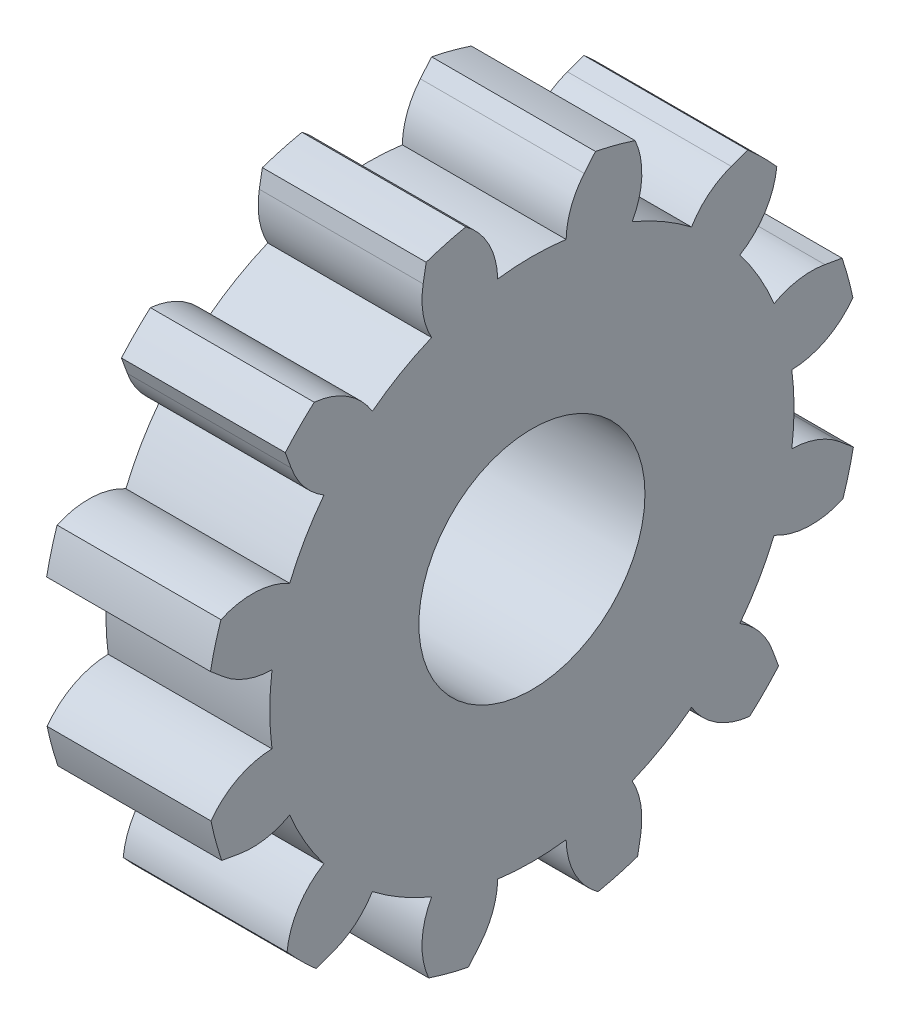
from build123d import *

# Parameters (mm, degrees)
SKETCH3_R           = 10
BOSS_EXTRUDE1_DEPTH = 5
CUT_EXTRUDE1_DEPTH  = 5
CIRPATTERN1_COUNT   = 12
SKETCH3_3_R         = 3.45
CUT_EXTRUDE3_DEPTH  = 5


with BuildPart() as part:
    # Sketch3 → Boss-Extrude1 (new body)
    with BuildSketch(Plane(origin=(0, 0, 0), x_dir=(0, 0, -1), z_dir=(1, 0, 0))):
        Circle(SKETCH3_R)
    extrude(amount=BOSS_EXTRUDE1_DEPTH)

    # Gear_Profile → Cut-Extrude1 (cut)
    with BuildSketch(Plane.ZY):
        with BuildLine():
            ThreePointArc((-1.595423995, 9.401352278), (-1.193917878, 8.71367126), (-1.044209538, 7.931558891))
            ThreePointArc((-1.044209538, 7.931558891), (0, 8), (1.044209538, 7.931558891))
            ThreePointArc((1.044209538, 7.931558891), (1.311715504, 8.977395553), (2.017271047, 9.794417671))
            ThreePointArc((2.017271047, 9.794417671), (0.040143535, 9.999919425), (-1.938570153, 9.810297945))
            Line((-1.938570153, 9.810297945), (-1.595423995, 9.401352278))
        make_face()
    cut_extrude1 = extrude(amount=-CUT_EXTRUDE1_DEPTH, mode=Mode.SUBTRACT)

    # CirPattern1: Cut-Extrude1 ×12 about axis
    cirpattern1_axis = Axis((5, 0, 0), (-1, 0, 0))
    for i in range(1, CIRPATTERN1_COUNT):
        add(cut_extrude1.rotate(cirpattern1_axis, i * 360 / CIRPATTERN1_COUNT), mode=Mode.SUBTRACT)

    # Sketch3<3> → Cut-Extrude3 (cut)
    with BuildSketch(Plane(origin=(0, 0, 0), x_dir=(0, 0, -1), z_dir=(1, 0, 0))):
        Circle(SKETCH3_3_R)
    extrude(amount=CUT_EXTRUDE3_DEPTH, mode=Mode.SUBTRACT)


solid = part.part
